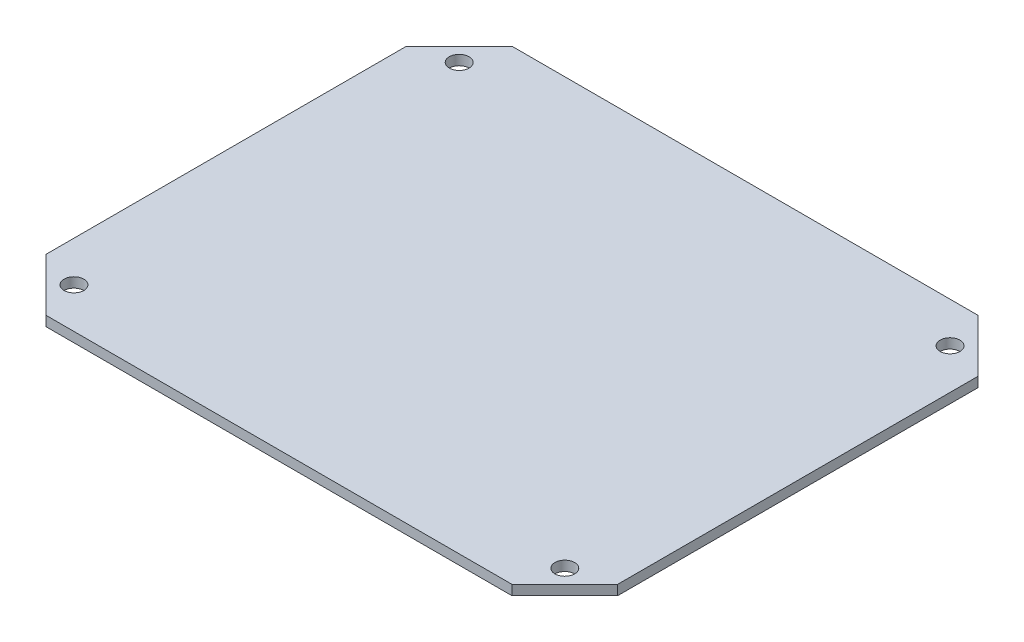
from build123d import *

# Parameters (mm, degrees)
SKETCH1_W             = 92
SKETCH1_H             = 75
BOSS_EXTRUDE1_DEPTH   = 1.59
CHAMFER1_SIZE         = 8.5
F_1_0MM_DOWEL_HOLE1_D = 3.18


with BuildPart() as part:
    # Sketch1 → Boss-Extrude1 (new body)
    with BuildSketch(Plane(origin=(0, 0, 0), x_dir=(1, 0, 0), z_dir=(0, 1, 0))):
        Rectangle(SKETCH1_W, SKETCH1_H)
    extrude(amount=BOSS_EXTRUDE1_DEPTH)

    # Chamfer1
    chamfer1_edges = [part.edges().sort_by_distance(p)[0] for p in [
        (-46, 0.795, 37.5),
        (-46, 0.795, -37.5),
        (46, 0.795, -37.5),
        (46, 0.795, 37.5),
    ]]
    chamfer(chamfer1_edges, length=CHAMFER1_SIZE)

    # Ø1.0mm Dowel Hole1 (through all)
    with Locations(Plane(origin=(0, 1.59, 0), x_dir=(1, 0, 0), z_dir=(0, 1, 0))):
        with Locations((-39.5, 31), (39.5, 31), (39.5, -31), (-39.5, -31)):
            Hole(F_1_0MM_DOWEL_HOLE1_D / 2)


solid = part.part
